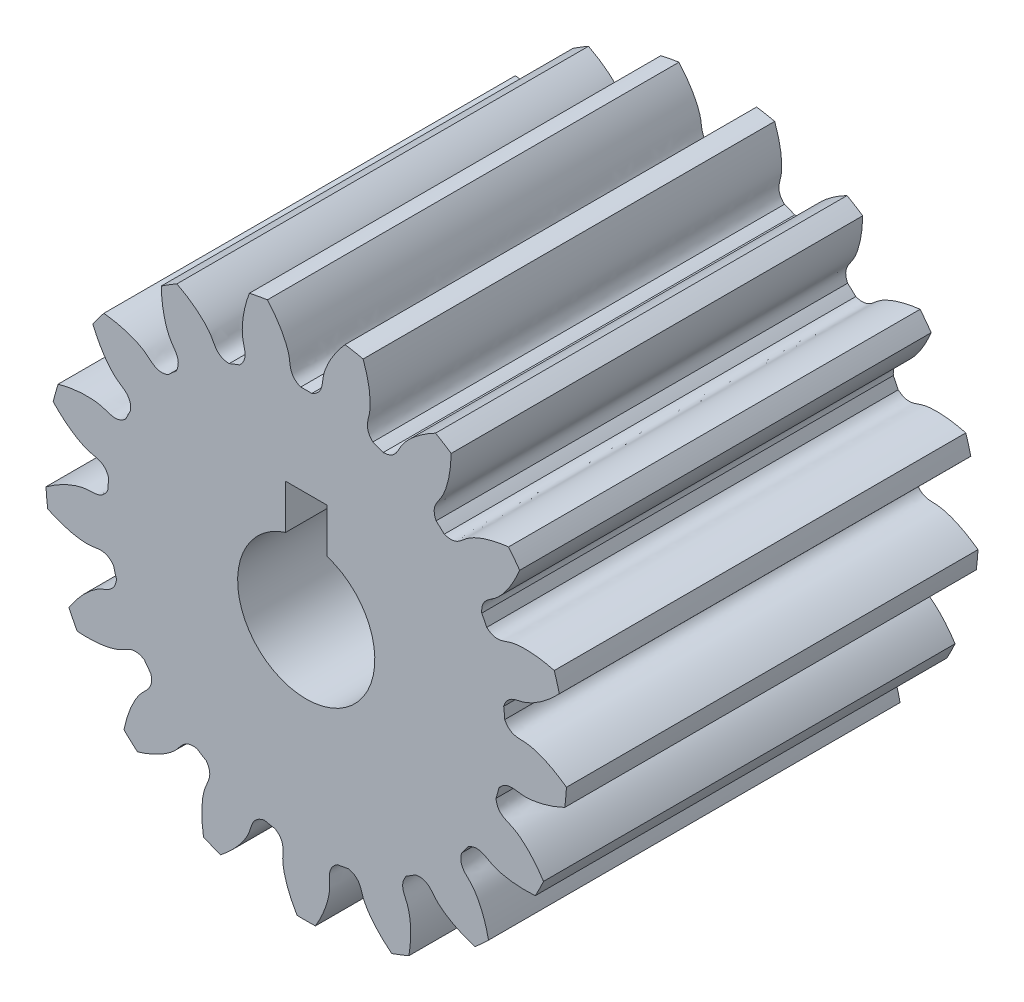
from build123d import *

# Parameters (mm, degrees)
SKETCH_1_R               = 19
EXTRUDE_1_DEPTH          = 30
CUT_EXTRUDE_1_DEPTH      = 41.274061131
PATTERN_CIRCULAR_1_COUNT = 17
CUT_EXTRUDE_2_DEPTH      = 41.259485855


with BuildPart() as part:
    # 草图1 → 凸台-拉伸1 (new body)
    with BuildSketch(Plane.XY):
        Circle(SKETCH_1_R)
    extrude(amount=EXTRUDE_1_DEPTH)

    # 草图2 → 切除-拉伸1 (cut, through all)
    with BuildSketch(Plane.XY):
        with BuildLine():
            ThreePointArc((0.403387494, 14.494387829), (0, 14.5), (-0.403387494, 14.494387829))
            add(Edge.make_bspline(
                [(-0.403387494, 14.494387829), (-1.255759481, 14.849644042), (-1.132390756, 15.509626813), (-1.276611209, 16.129648275), (-1.289951469, 16.18230119), (-1.306037005, 16.240838627), (-1.32510118, 16.305170665), (-1.347383555, 16.375198727), (-1.373118159, 16.450817515), (-1.40253689, 16.531914502), (-1.435868224, 16.618370188), (-1.473337358, 16.710058129), (-1.515165928, 16.80684504), (-1.561571855, 16.908590882), (-1.612769151, 17.015148962), (-1.66896775, 17.12636603), (-1.730373323, 17.242082389), (-1.797187111, 17.362132), (-1.869605751, 17.4863426), (-1.947821109, 17.61453582), (-2.032020115, 17.746527309), (-2.1223846, 17.882126855), (-2.219091138, 18.021138524), (-2.32231089, 18.163360791), (-2.432209452, 18.308586678), (-2.548946705, 18.456603899), (-2.67267667, 18.607195006), (-2.803547366, 18.760137539), (-2.941700674, 18.915204179), (-3.087272199, 19.072162909), (-3.24039114, 19.23077717), (-3.401180166, 19.390806026), (-3.569755292, 19.552004336), (-3.746225758, 19.71412292), (-3.930693918, 19.876908731), (-4.123255131, 20.040105038), (-4.323997649, 20.203451599), (-4.533002522, 20.366684847), (-4.750343497, 20.529538073), (-4.976086928, 20.691741613), (-5.210291694, 20.853023038), (-5.453009069, 21.013107349), (-5.79164327, 21.226861067), (-6.053153804, 21.381051942), (-6.231291666, 21.481438237)],
                knots=[0, 0, 0, 0, 0.193882922, 0.199023975, 0.204850501, 0.211362501, 0.218559975, 0.226442923, 0.235011345, 0.24426524, 0.254204608, 0.264829451, 0.276139767, 0.288135557, 0.300816821, 0.314183558, 0.328235769, 0.342973453, 0.358396612, 0.374505244, 0.39129935, 0.408778929, 0.426943982, 0.445794509, 0.46533051, 0.485551984, 0.506458932, 0.528051354, 0.550329249, 0.573292619, 0.596941461, 0.621275778, 0.646295568, 0.672000832, 0.69839157, 0.725467781, 0.753229466, 0.781676625, 0.810809257, 0.840627364, 0.871130943, 0.902319997, 0.934194524, 1, 1, 1, 1], degree=3))
            ThreePointArc((-6.231291666, 21.481438237), (0, 22.366966369), (6.231291666, 21.481438237))
            add(Edge.make_bspline(
                [(0.403387494, 14.494387829), (1.255759481, 14.849644042), (1.132390756, 15.509626813), (1.276611209, 16.129648275), (1.289951469, 16.18230119), (1.306037005, 16.240838627), (1.32510118, 16.305170665), (1.347383555, 16.375198727), (1.373118159, 16.450817515), (1.40253689, 16.531914502), (1.435868224, 16.618370188), (1.473337358, 16.710058129), (1.515165928, 16.80684504), (1.561571855, 16.908590882), (1.612769151, 17.015148962), (1.66896775, 17.12636603), (1.730373323, 17.242082389), (1.797187111, 17.362132), (1.869605751, 17.4863426), (1.947821109, 17.61453582), (2.032020115, 17.746527309), (2.1223846, 17.882126855), (2.219091138, 18.021138524), (2.32231089, 18.163360791), (2.432209452, 18.308586678), (2.548946705, 18.456603899), (2.67267667, 18.607195006), (2.803547366, 18.760137539), (2.941700674, 18.915204179), (3.087272199, 19.072162909), (3.24039114, 19.23077717), (3.401180166, 19.390806026), (3.569755292, 19.552004336), (3.746225758, 19.71412292), (3.930693918, 19.876908731), (4.123255131, 20.040105038), (4.323997649, 20.203451599), (4.533002522, 20.366684847), (4.750343497, 20.529538073), (4.976086928, 20.691741613), (5.210291694, 20.853023038), (5.453009069, 21.013107349), (5.79164327, 21.226861067), (6.053153804, 21.381051942), (6.231291666, 21.481438237)],
                knots=[0, 0, 0, 0, 0.193882922, 0.199023975, 0.204850501, 0.211362501, 0.218559975, 0.226442923, 0.235011345, 0.24426524, 0.254204608, 0.264829451, 0.276139767, 0.288135557, 0.300816821, 0.314183558, 0.328235769, 0.342973453, 0.358396612, 0.374505244, 0.39129935, 0.408778929, 0.426943982, 0.445794509, 0.46533051, 0.485551984, 0.506458932, 0.528051354, 0.550329249, 0.573292619, 0.596941461, 0.621275778, 0.646295568, 0.672000832, 0.69839157, 0.725467781, 0.753229466, 0.781676625, 0.810809257, 0.840627364, 0.871130943, 0.902319997, 0.934194524, 1, 1, 1, 1], degree=3))
        make_face()
    cut_extrude_1 = extrude(amount=CUT_EXTRUDE_1_DEPTH, mode=Mode.SUBTRACT)

    # 阵列(圆周)1: 切除-拉伸1 ×17 about axis
    pattern_circular_1_axis = Axis((0, 0, -1.5), (0, 0, 1))
    for i in range(1, PATTERN_CIRCULAR_1_COUNT):
        add(cut_extrude_1.rotate(pattern_circular_1_axis, i * 360 / PATTERN_CIRCULAR_1_COUNT), mode=Mode.SUBTRACT)

    # 草图4 → 切除-拉伸2 (cut, through all)
    with BuildSketch(Plane.XY.offset(30)):
        with BuildLine():
            Line((1.5, 4.769696007), (1.5, 8))
            Line((1.5, 8), (-1.5, 8))
            Line((-1.5, 8), (-1.5, 4.769696007))
            ThreePointArc((-1.5, 4.769696007), (0, -5), (1.5, 4.769696007))
        make_face()
    extrude(amount=-CUT_EXTRUDE_2_DEPTH, mode=Mode.SUBTRACT)


solid = part.part
